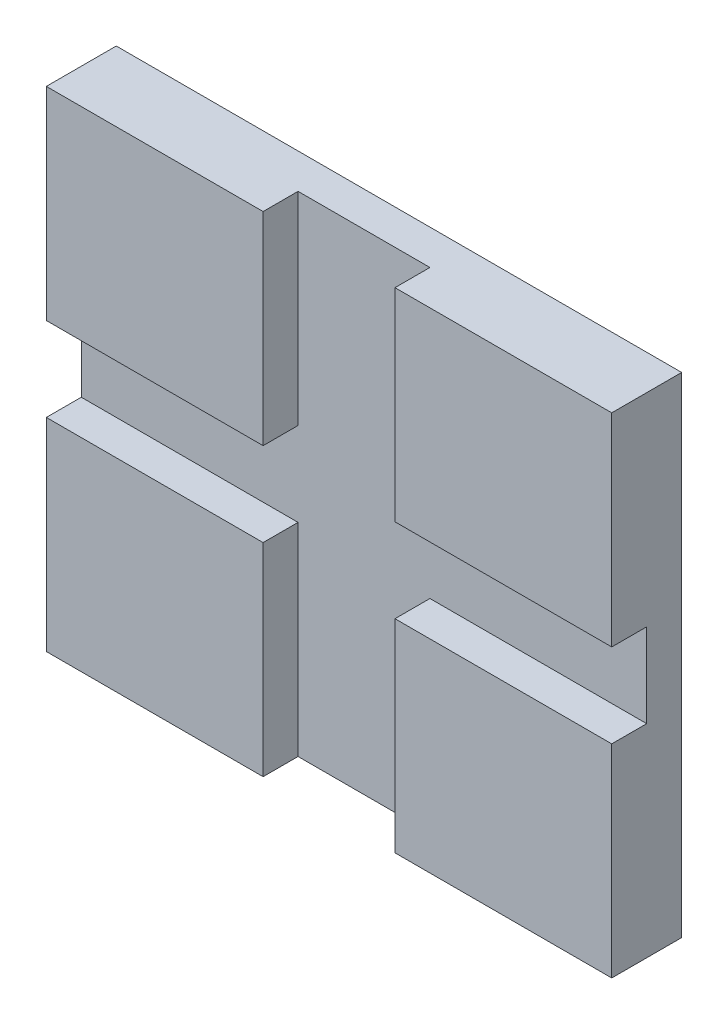
from build123d import *

# Parameters (mm, degrees)
SKETCH1_W           = 80.86
SKETCH1_H           = 70
BOSS_EXTRUDE1_DEPTH = 10
SKETCH2_W           = 62
SKETCH2_H           = 58
BOSS_EXTRUDE2_DEPTH = 10


with BuildPart() as part:
    # Sketch1 → Boss-Extrude1 (new body)
    with BuildSketch(Plane.XY):
        with Locations((-40.43, -35)):
            Rectangle(SKETCH1_W, SKETCH1_H)
    extrude(amount=BOSS_EXTRUDE1_DEPTH)

    # Sketch2 → Boss-Extrude2 (add)
    with BuildSketch(Plane.XY.offset(10)):
        with Locations((-49.86, -41)):
            Rectangle(SKETCH2_W, SKETCH2_H)
    extrude(amount=BOSS_EXTRUDE2_DEPTH)

    # Mirror1: part across plane


with BuildPart() as part_1:
    add(part.part)
    add(part.part.mirror(Plane(origin=(0, 0, 10), x_dir=(0, 0, 1), z_dir=(-1, 0, 0))))

    # Mirror2: part across plane


with BuildPart() as part_2:
    add(part_1.part)
    add(part_1.part.mirror(Plane(origin=(-80.86, 0, 10), x_dir=(0, 0, 1), z_dir=(0, -1, 0))))


solid = part_2.part
